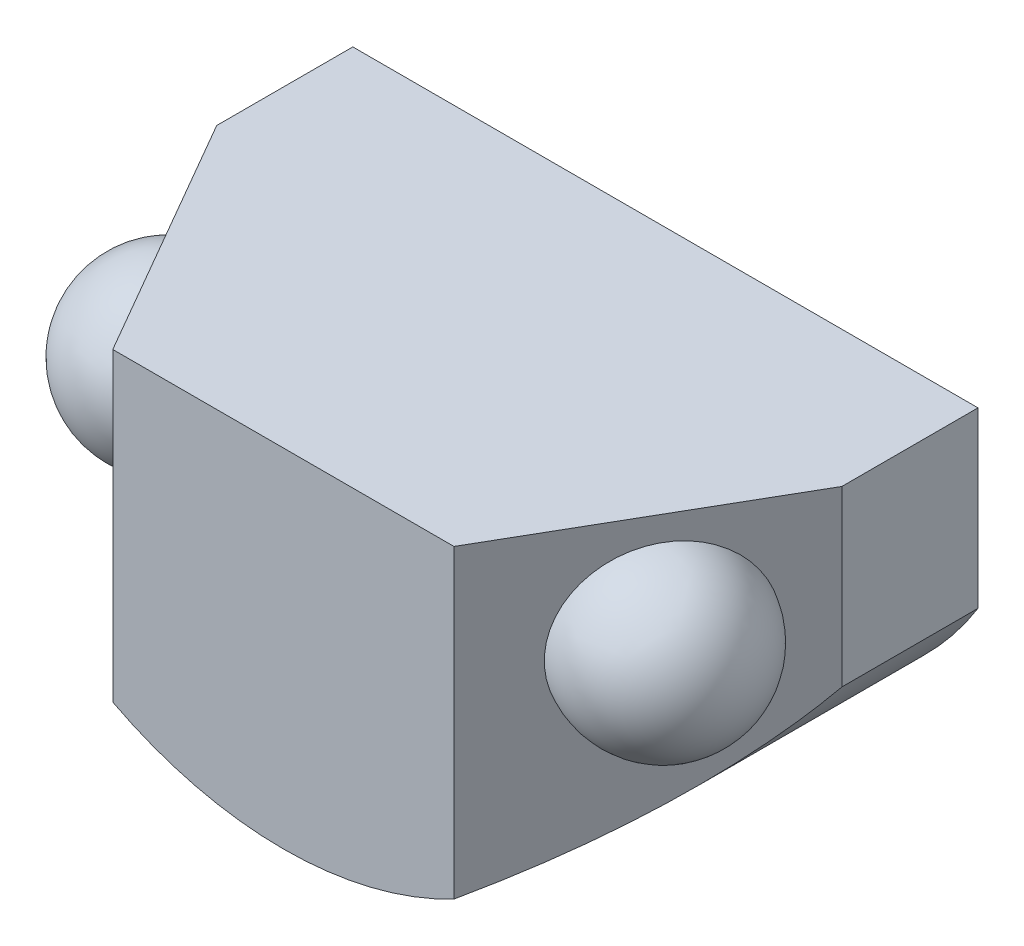
from build123d import *

# Parameters (mm, degrees)
SKETCH1_W                = 180
SKETCH1_H                = 110
BOSS_EXTRUDE1_DEPTH      = 50
BOSS_EXTRUDE2_DEPTH      = 110
CUT_EXTRUDE1_DEPTH       = 146.344418537
BOSS_EXTRUDE5_DEPTH      = 10
BOSS_EXTRUDE5_DEPTH_BACK = 10
SKETCH5_R                = 5


with BuildPart() as part:
    # Sketch1 → Boss-Extrude1 (new body)
    with BuildSketch(Plane(origin=(0, 0, 0), x_dir=(1, 0, 0), z_dir=(0, 1, 0))):
        Rectangle(SKETCH1_W, SKETCH1_H)
    extrude(amount=BOSS_EXTRUDE1_DEPTH)

    # Sketch2 → Boss-Extrude2 (add)
    with BuildSketch(Plane(origin=(-35, 0, -55), x_dir=(1, 0, 0), z_dir=(0, 0, 1))):
        with BuildLine():
            Line((-55, 0), (125, 0))
            ThreePointArc((125, 0), (35, -50), (-55, 0))
        make_face()
    extrude(amount=BOSS_EXTRUDE2_DEPTH)

    # Sketch3 → Cut-Extrude1 (cut, through all)
    with BuildSketch(Plane(origin=(0, 50, 0), x_dir=(1, 0, 0), z_dir=(0, 1, 0))):
        Polygon((-49.118803686, -55), (-90, 15.808309091), (-90, -55), align=None)
    cut_extrude1 = extrude(amount=-CUT_EXTRUDE1_DEPTH, mode=Mode.SUBTRACT)

    # Mirror1: Cut-Extrude1 across plane
    add(cut_extrude1.mirror(Plane(origin=(0, 0, 0), x_dir=(0, 0, 1), z_dir=(1, 0, 0))), mode=Mode.SUBTRACT)

    # Sketch5 → Boss-Extrude5 (add, two sides: drawn at the far end of the back side and taken through both)
    with BuildSketch(Plane(origin=(0, 0, -55), x_dir=(-1, 0, 0), z_dir=(0, 0, -1)).offset(-BOSS_EXTRUDE5_DEPTH_BACK)):
        Circle(SKETCH5_R)
    extrude(amount=BOSS_EXTRUDE5_DEPTH + BOSS_EXTRUDE5_DEPTH_BACK)

    # Sketch4 → Revolve1 (revolve)
    with BuildSketch(Plane(origin=(-60.654801368, 0, 35.019065898), x_dir=(0.49999999999999495, 0, 0.8660254037844417), z_dir=(-0.8660254037844417, 0, 0.49999999999999495))):
        with BuildLine():
            ThreePointArc((-20.965161058, 42.942576489), (4.034838942, 17.942576489), (-20.965161058, -7.057423511))
            Line((-20.965161058, -7.057423511), (-20.965161058, 42.942576489))
        make_face()
    revolve1 = revolve(axis=Axis((-71.137381897, 42.942576489, 16.862703827), (0, -1, 0)))

    # Mirror2: Revolve1 across plane
    add(revolve1.mirror(Plane(origin=(0, 0, 0), x_dir=(0, 0, 1), z_dir=(1, 0, 0))))


solid = part.part
